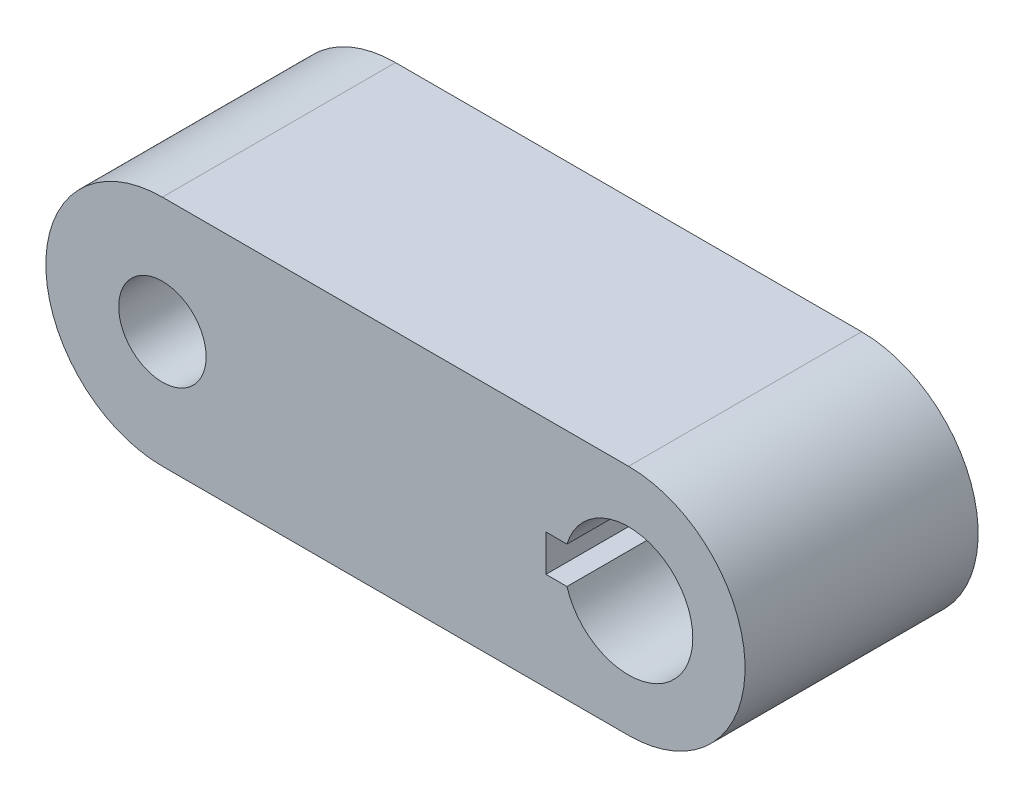
from build123d import *

# Parameters (mm, degrees)
MAIN_BODY_DEPTH                = 6.35
F_3_16_0_1875_DIAMETER_HOLE1_D = 4.7625
F_7_0_7_DIAMETER_HOLE1_D       = 7
F_7_0_7_DIAMETER_HOLE1_DEPTH   = 12.7
F_7_0_7_DIAMETER_HOLE1_TIP     = 2.103012167
SKETCH6_W                      = 2.5
SKETCH6_H                      = 2
CUT_2X2_KEYWAY_DEPTH           = 35.780382402


with BuildPart() as part:
    # Sketch1 → Main Body (new, symmetric)
    with BuildSketch(Plane.XY):
        with BuildLine():
            Line((0, 6.35), (25.4, 6.35))
            ThreePointArc((25.4, 6.35), (31.75, 0), (25.4, -6.35))
            Line((25.4, -6.35), (0, -6.35))
            ThreePointArc((0, -6.35), (-6.35, 0), (0, 6.35))
        make_face()
    extrude(amount=MAIN_BODY_DEPTH, both=True)

    # 3/16 (0.1875) Diameter Hole1 (through all)
    with Locations(Plane.XY.offset(6.35)):
        with Locations((0, 0)):
            Hole(F_3_16_0_1875_DIAMETER_HOLE1_D / 2)

    # Ø7.0 (7) Diameter Hole1
    with Locations(Plane.XY.offset(6.35)):
        with Locations((25.4, 0)):
            Hole(F_7_0_7_DIAMETER_HOLE1_D / 2, depth=F_7_0_7_DIAMETER_HOLE1_DEPTH)
            with Locations((0, 0, -(F_7_0_7_DIAMETER_HOLE1_DEPTH + F_7_0_7_DIAMETER_HOLE1_TIP / 2))):  # 118° drill point
                Cone(0, F_7_0_7_DIAMETER_HOLE1_D / 2, F_7_0_7_DIAMETER_HOLE1_TIP, mode=Mode.SUBTRACT)

    # Sketch6 → Cut-2x2 Keyway (cut, through all)
    with BuildSketch(Plane.XY.offset(6.35)):
        with Locations((22.15, 0)):
            Rectangle(SKETCH6_W, SKETCH6_H)
    extrude(amount=-CUT_2X2_KEYWAY_DEPTH, mode=Mode.SUBTRACT)


solid = part.part
